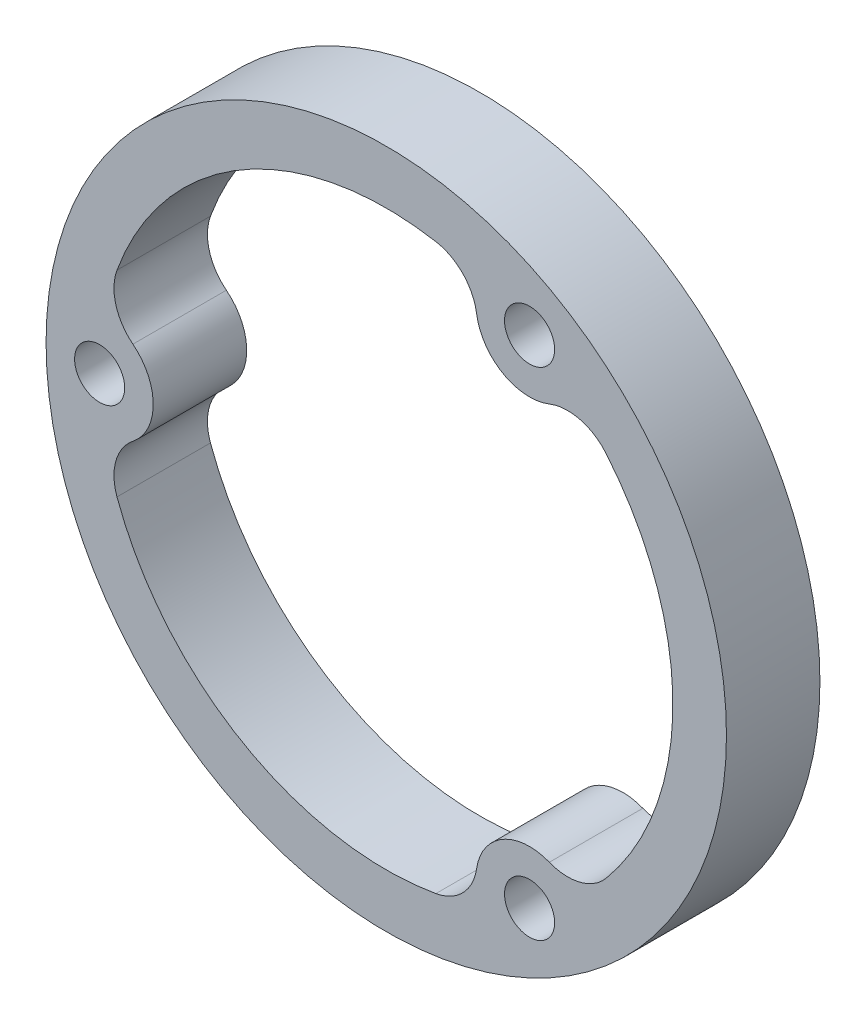
from build123d import *

# Parameters (mm, degrees)
SKETCH1_R              = 34.671
BOSS_EXTRUDE1_DEPTH    = 9.525
FILLET1_R              = 5.08
F_10_CLEARANCE_HOLE1_D = 5.1054


with BuildPart() as part:
    # Sketch1 → Boss-Extrude1 (new body)
    with BuildSketch(Plane.XY):
        with Locations(Location((0, 0, 0), (0, 0, 180))):
            Circle(SKETCH1_R)
        with BuildLine():
            ThreePointArc((19.058413969, -22.135965238), (29.21, 0), (19.058413969, 22.135965238))
            ThreePointArc((19.058413969, 22.135965238), (11.8745, 20.567237314), (9.641101249, 27.573053271))
            ThreePointArc((9.641101249, 27.573053271), (-14.605, 25.296602045), (-28.699515217, 5.437088034))
            ThreePointArc((-28.699515217, 5.437088034), (-23.749, 0), (-28.699515217, -5.437088034))
            ThreePointArc((-28.699515217, -5.437088034), (-14.605, -25.296602045), (9.641101249, -27.573053271))
            ThreePointArc((9.641101249, -27.573053271), (11.8745, -20.567237314), (19.058413969, -22.135965238))
        make_face(mode=Mode.SUBTRACT)
    extrude(amount=BOSS_EXTRUDE1_DEPTH)

    # Fillet1
    fillet1_edges = [part.edges().sort_by_distance(p)[0] for p in [
        (-28.699515217, 5.437088034, 4.7625),
        (-28.699515217, -5.437088034, 4.7625),
        (9.641101249, -27.573053271, 4.7625),
        (19.058413969, -22.135965238, 4.7625),
        (19.058413969, 22.135965238, 4.7625),
        (9.641101249, 27.573053271, 4.7625),
    ]]
    fillet(fillet1_edges, radius=FILLET1_R)

    # #10 Clearance Hole1 (through all)
    with Locations(Plane(origin=(0, 0, 0), x_dir=(-1, 0, 0), z_dir=(0, 0, -1))):
        with Locations((-14.605, 25.296602045), (29.21, 0), (-14.605, -25.296602045)):
            Hole(F_10_CLEARANCE_HOLE1_D / 2)


solid = part.part
